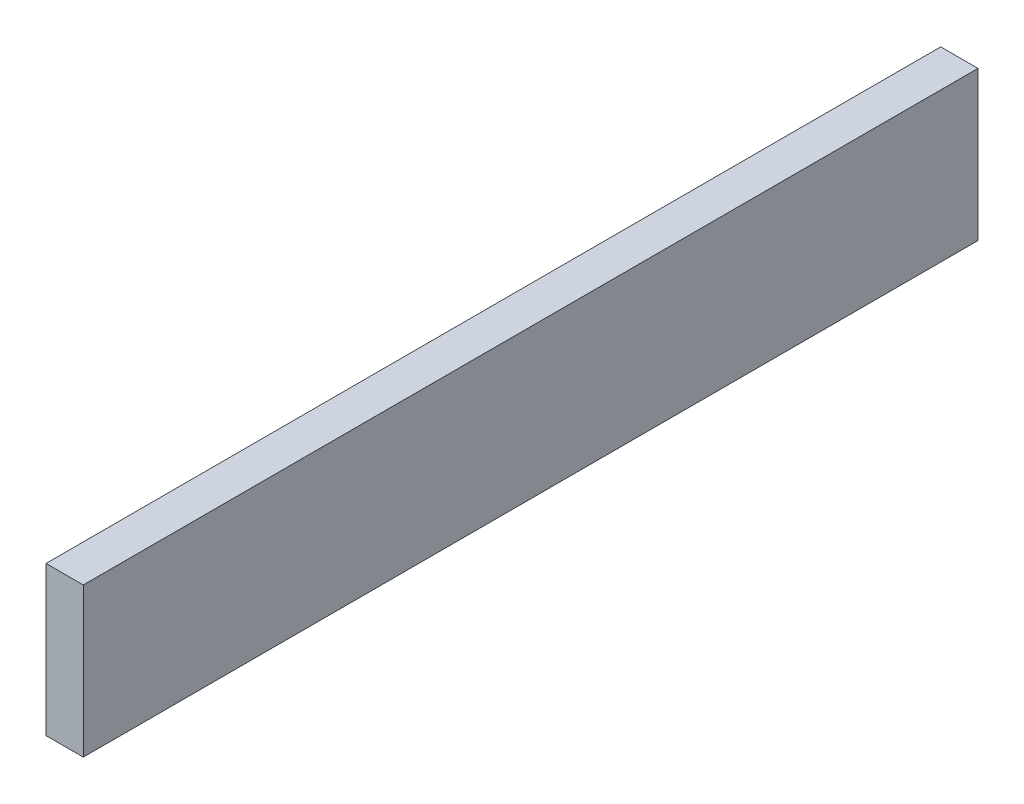
from build123d import *

# Parameters (mm, degrees)
SKETCH1_W           = 76.2
SKETCH1_H           = 12.7
BOSS_EXTRUDE1_DEPTH = 3.175


with BuildPart() as part:
    # Sketch1 → Boss-Extrude1 (new body)
    with BuildSketch(Plane(origin=(0, 0, 0), x_dir=(0, 0, -1), z_dir=(1, 0, 0))):
        Rectangle(SKETCH1_W, SKETCH1_H)
    extrude(amount=BOSS_EXTRUDE1_DEPTH)


solid = part.part
